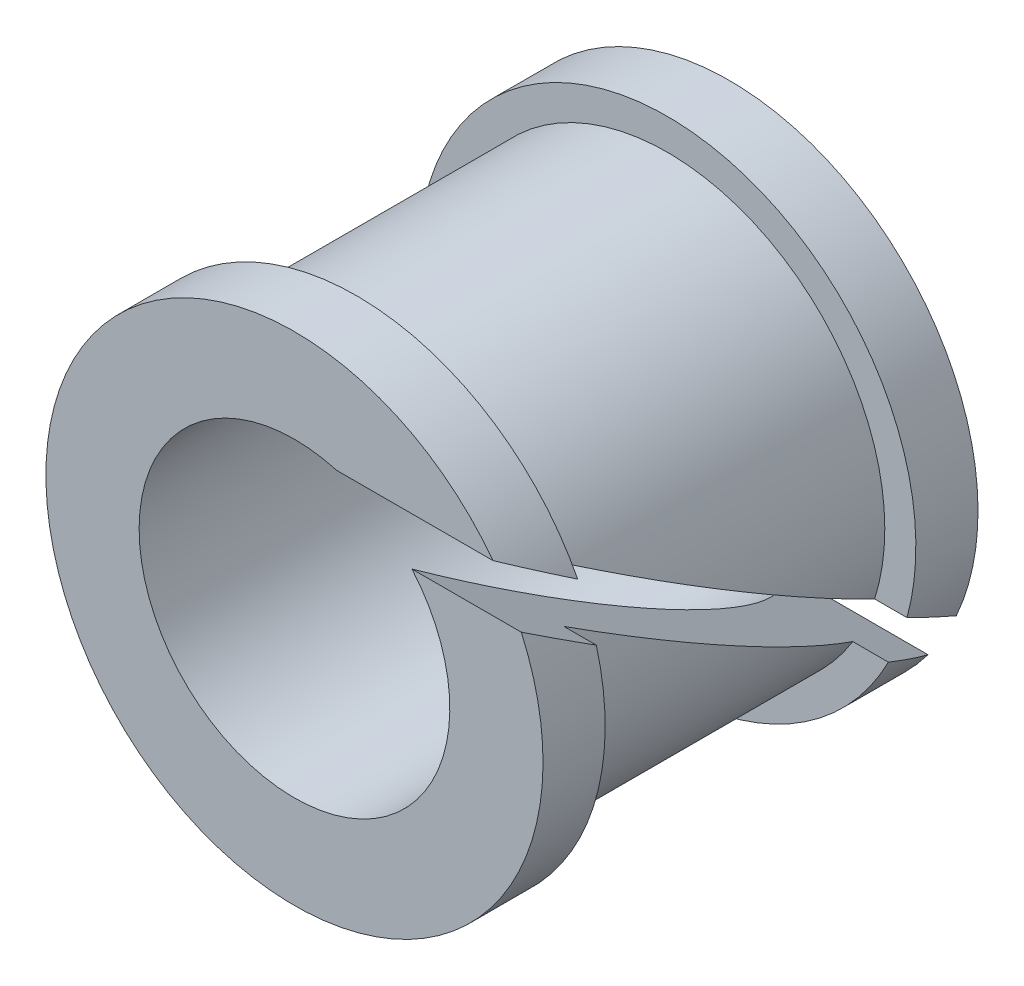
from build123d import *

# Parameters (mm, degrees)
F_3_0MM_DOWEL_HOLE1_D = 3
CUT_EXTRUDE1_DEPTH    = 4.991240409


with BuildPart() as part:
    # Sketch1 → Revolve1 (revolve)
    with BuildSketch(Plane(origin=(0, 0, 0), x_dir=(0, 0, -1), z_dir=(1, 0, 0)), mode=Mode.PRIVATE) as revolve1_sk:
        Polygon((-1.5, 2.4), (-1.5, 2.1), (1.5, 2.1), (1.5, 2.4), (2.1, 2.4), (2.1, 0), (-2.1, 0), (-2.1, 2.4), align=None)
    revolve(revolve1_sk.sketch.rotate(Axis((0, 0, 2.1), (0, 0, -1)), 90), axis=Axis((0, 0, 2.1), (0, 0, -1)))

    # Ø3.0mm Dowel Hole1 (through all)
    with Locations(Plane.XY.offset(2.1)):
        with Locations((0, 0)):
            Hole(F_3_0MM_DOWEL_HOLE1_D / 2)

    # Sketch4 → Cut-Extrude1 (cut, through all)
    with BuildSketch(Plane(origin=(0, 0, 0), x_dir=(0, 0, -1), z_dir=(1, 0, 0))):
        Polygon((-2.3, 1.096965511), (-2.1, 1.443375673), (2.3, -1.096965511), (2.1, -1.443375673), align=None)
    extrude(amount=CUT_EXTRUDE1_DEPTH, mode=Mode.SUBTRACT)


solid = part.part
